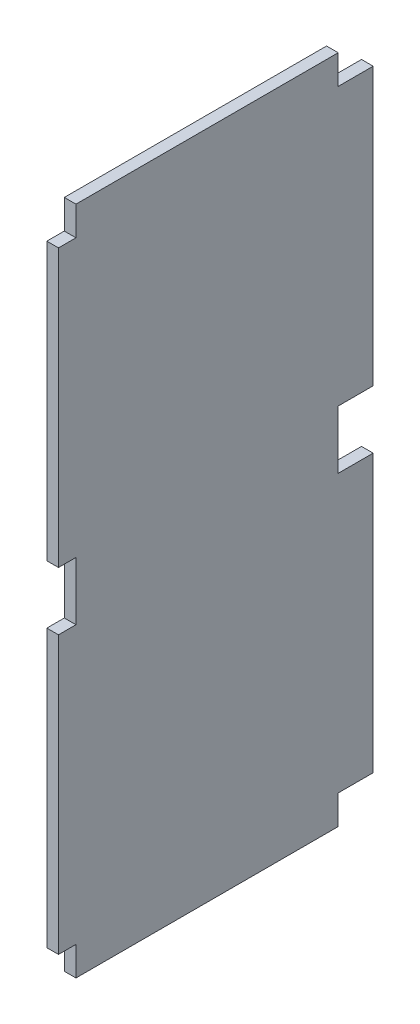
from build123d import *

# Parameters (mm, degrees)
ESTRUSIONE_ESTRUSIONE1_DEPTH      = 48
ESTRUSIONE_ESTRUSIONE1_DEPTH_BACK = 6
SCHIZZO1_W                        = 2
SCHIZZO1_H                        = 105
TAGLIO_ESTRUSIONE1_DEPTH          = 10
SCHIZZO3_W                        = 2
SCHIZZO3_H                        = 45
ESTRUSIONE_ESTRUSIONE2_DEPTH      = 5


with BuildPart() as part:
    # Schizzo1 → Estrusione-Estrusione1 (new, two sides: drawn at the far end of the back side and taken through both)
    with BuildSketch(Plane.XY.offset(-ESTRUSIONE_ESTRUSIONE1_DEPTH_BACK)):
        with Locations((5, 0)):
            Rectangle(SCHIZZO1_W, SCHIZZO1_H)
    extrude(amount=ESTRUSIONE_ESTRUSIONE1_DEPTH + ESTRUSIONE_ESTRUSIONE1_DEPTH_BACK)

    # Schizzo2 → Taglio-Estrusione1 (cut)
    with BuildSketch(Plane(origin=(6, 0, 0), x_dir=(0, 0, -1), z_dir=(1, 0, 0))):
        Polygon((-48, -5), (-45, -5), (-45, 0), (-45, 5), (-48, 5), align=None)
        Polygon((6, -5), (0, -5), (0, 0), (0, 5), (6, 5), align=None)
    extrude(amount=-TAGLIO_ESTRUSIONE1_DEPTH, mode=Mode.SUBTRACT)

    # Schizzo3 → Estrusione-Estrusione2 (add)
    with BuildSketch(Plane.XZ.offset(52.5)):
        with Locations((5, 22.5)):
            Rectangle(SCHIZZO3_W, SCHIZZO3_H)
    estrusione_estrusione2 = extrude(amount=ESTRUSIONE_ESTRUSIONE2_DEPTH)

    # Specchia1: Estrusione-Estrusione2 across plane
    add(estrusione_estrusione2.mirror(Plane(origin=(0, 0, 0), x_dir=(0, 0, 1), z_dir=(0, -1, 0))))


solid = part.part
